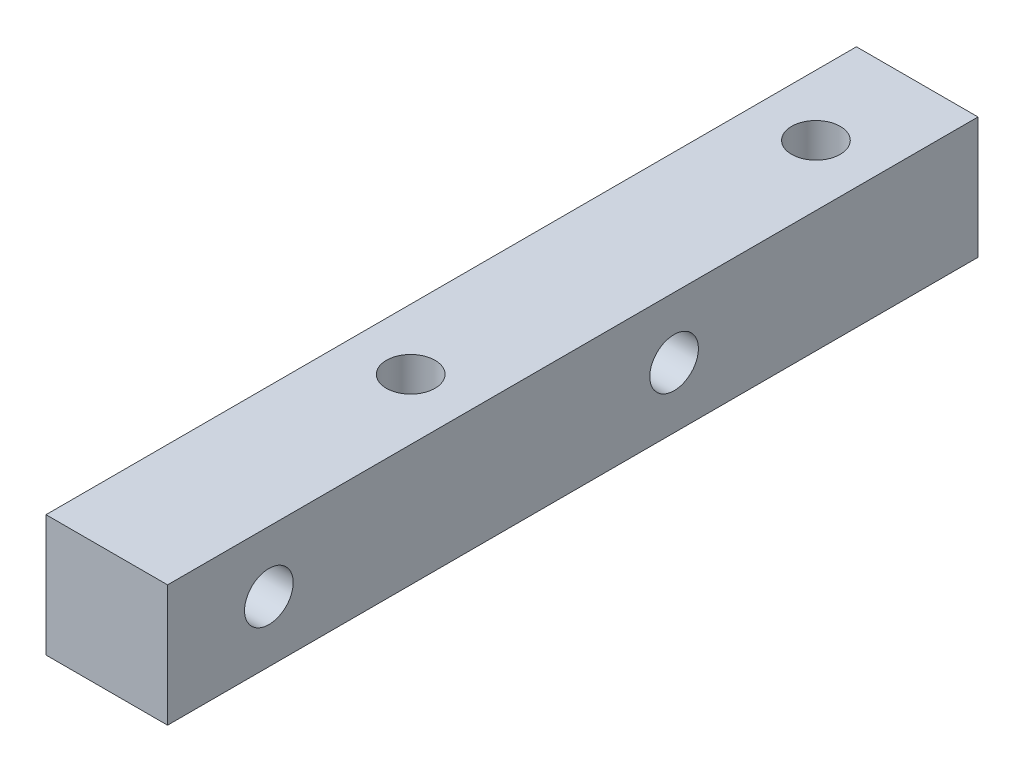
from build123d import *

# Parameters (mm, degrees)
SKETCH_1_W          = 6
SKETCH_1_H          = 6
EXTRUDE_1_DEPTH     = 40
SKETCH_2_R          = 1.2
CUT_EXTRUDE_1_DEPTH = 50
SKETCH_3_R          = 1.2
CUT_EXTRUDE_2_DEPTH = 50


with BuildPart() as part:
    # 草图1 → 凸台-拉伸1 (new body)
    with BuildSketch(Plane.XY):
        with Locations((3, 3)):
            Rectangle(SKETCH_1_W, SKETCH_1_H)
    extrude(amount=EXTRUDE_1_DEPTH)

    # 草图2 → 切除-拉伸1 (cut)
    with BuildSketch(Plane(origin=(0, 6, 0), x_dir=(1, 0, 0), z_dir=(0, 1, 0))):
        with Locations(Location((3, -5, 0), (0, 0, 270))):
            Circle(SKETCH_2_R)
        with Locations(Location((3, -25, 0), (0, 0, 270))):
            Circle(SKETCH_2_R)
    extrude(amount=-CUT_EXTRUDE_1_DEPTH, mode=Mode.SUBTRACT)

    # 草图3 → 切除-拉伸2 (cut)
    with BuildSketch(Plane.ZY):
        with Locations((35, 3)):
            Circle(SKETCH_3_R)
        with Locations((15, 3)):
            Circle(SKETCH_3_R)
    extrude(amount=-CUT_EXTRUDE_2_DEPTH, mode=Mode.SUBTRACT)


solid = part.part
